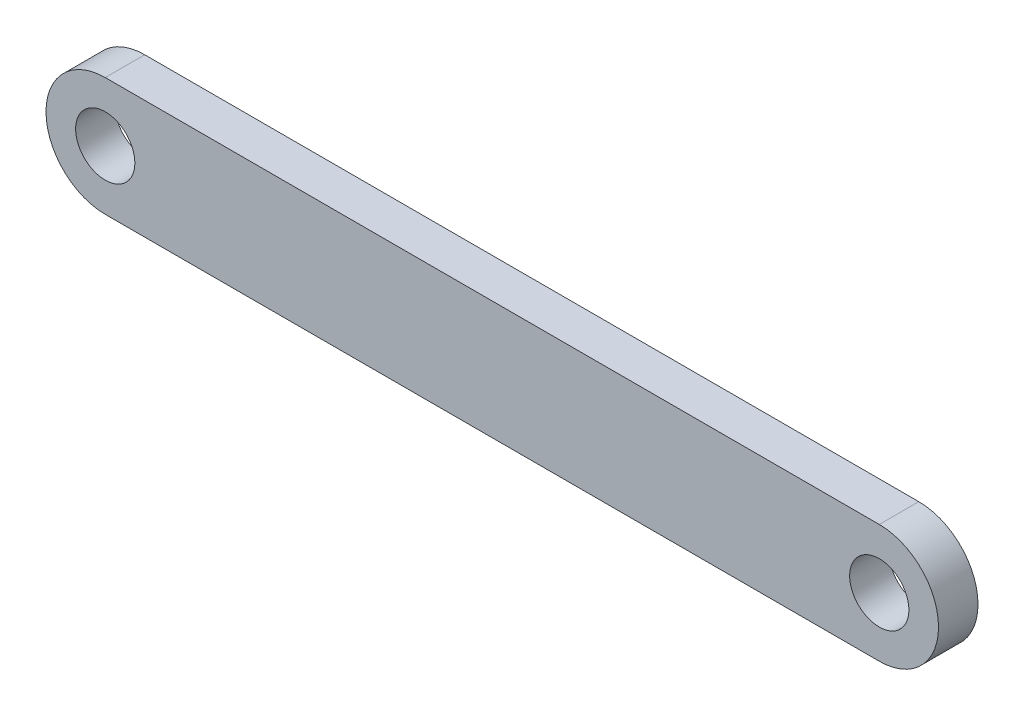
from build123d import *

# Parameters (mm, degrees)
SKETCH1_W           = 143.51
SKETCH1_H           = 19.05
BOSS_EXTRUDE1_DEPTH = 6.35
SKETCH3_R           = 4.7625
CUT_EXTRUDE1_DEPTH  = 6.35
FILLET5_RADIUS      = 9.525
FILLET5_LENGTH      = 6.35
FILLET6_RADIUS      = 9.525
FILLET6_LENGTH      = 6.35


with BuildPart() as part:
    # Sketch1 → Boss-Extrude1 (new body)
    with BuildSketch(Plane.XY):
        with Locations((9.136619712, 9.525)):
            Rectangle(SKETCH1_W, SKETCH1_H)
    extrude(amount=BOSS_EXTRUDE1_DEPTH)

    # Sketch3 → Cut-Extrude1 (cut)
    with BuildSketch(Plane.XY):
        with Locations((-53.093380288, 9.525)):
            Circle(SKETCH3_R)
        with Locations((71.366619712, 9.525)):
            Circle(SKETCH3_R)
    extrude(amount=CUT_EXTRUDE1_DEPTH, mode=Mode.SUBTRACT)

    # Fillet5: full round fillet: the end face becomes a half cylinder, R = half its width
    fillet5_face = Plane((-62.618380288, 9.525, 3.175), x_dir=(0, 0, -1), z_dir=(-1, 0, 0))  # on the end face: x along it, z out of the body
    fillet5_slab = fillet5_face.offset(-FILLET5_RADIUS / 2) * Box(FILLET5_LENGTH, 2 * FILLET5_RADIUS, FILLET5_RADIUS, mode=Mode.PRIVATE)  # the body's end, R deep
    fillet5_round = Plane((-53.093380288, 9.525, 3.175), x_dir=(-1, 0, 0), z_dir=(0, 0, -1)) * Cylinder(FILLET5_RADIUS, FILLET5_LENGTH, mode=Mode.PRIVATE)  # its axis R under the face
    add(fillet5_slab - fillet5_round, mode=Mode.SUBTRACT)

    # Fillet6: full round fillet: the end face becomes a half cylinder, R = half its width
    fillet6_face = Plane((80.891619712, 9.525, 3.175), x_dir=(0, 0, 1), z_dir=(1, 0, 0))  # on the end face: x along it, z out of the body
    fillet6_slab = fillet6_face.offset(-FILLET6_RADIUS / 2) * Box(FILLET6_LENGTH, 2 * FILLET6_RADIUS, FILLET6_RADIUS, mode=Mode.PRIVATE)  # the body's end, R deep
    fillet6_round = Plane((71.366619712, 9.525, 3.175), x_dir=(1, 0, 0), z_dir=(0, 0, 1)) * Cylinder(FILLET6_RADIUS, FILLET6_LENGTH, mode=Mode.PRIVATE)  # its axis R under the face
    add(fillet6_slab - fillet6_round, mode=Mode.SUBTRACT)


solid = part.part
